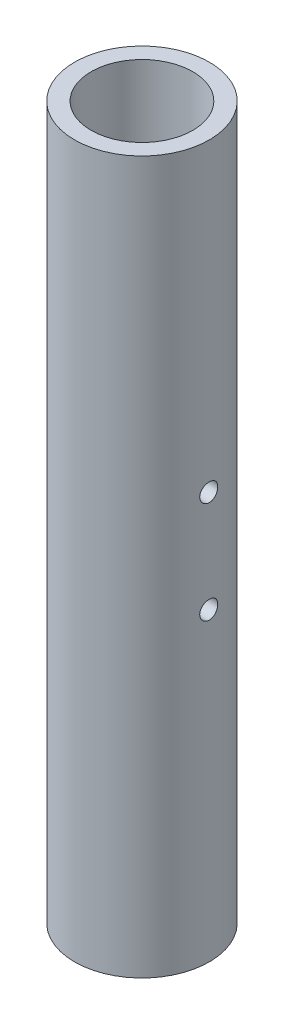
from build123d import *

# Parameters (mm, degrees)
SKETCH1_R               = 16.8275
SKETCH1_R_2             = 12.7
BOSS_EXTRUDE1_DEPTH     = 177.8
CUT_EXTRUDE1_DEPTH      = 180.385533175
CUT_EXTRUDE1_DEPTH_BACK = 180.385533175
SKETCH2_R               = 2.2479


with BuildPart() as part:
    # Sketch1 → Boss-Extrude1 (new body)
    with BuildSketch(Plane(origin=(0, 0, 0), x_dir=(1, 0, 0), z_dir=(0, 1, 0))):
        with Locations(Location((0, 0, 0), (0, 0, 270))):
            Circle(SKETCH1_R)
        with Locations(Location((0, 0, 0), (0, 0, 270))):
            Circle(SKETCH1_R_2, mode=Mode.SUBTRACT)
    extrude(amount=BOSS_EXTRUDE1_DEPTH)

    # Sketch2 → Cut-Extrude1 (cut, two sides: drawn at the far end of the back side and taken through both)
    with BuildSketch(Plane(origin=(0, 0, 0), x_dir=(0, 0, -1), z_dir=(1, 0, 0)).offset(-CUT_EXTRUDE1_DEPTH_BACK)):
        with Locations((0, 76.2)):
            Circle(SKETCH2_R)
        with Locations((0, 101.6)):
            Circle(SKETCH2_R)
    extrude(amount=CUT_EXTRUDE1_DEPTH + CUT_EXTRUDE1_DEPTH_BACK, mode=Mode.SUBTRACT)


solid = part.part
